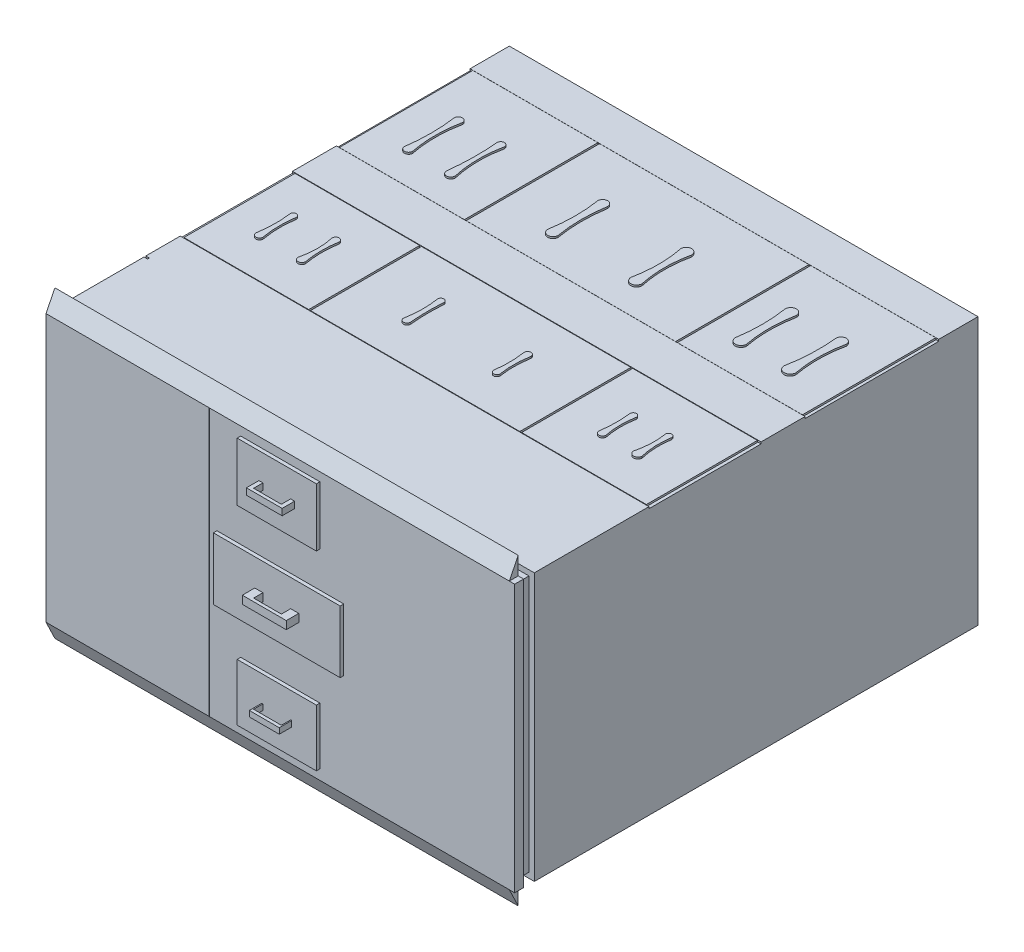
from build123d import *

# Parameters (mm, degrees)
CROQUIS1_W               = 2630
CROQUIS1_H               = 1500
SALIENTE_EXTRUIR1_DEPTH  = 2600
CROQUIS2_W               = 1800
CROQUIS2_H               = 700
CROQUIS2_W_2             = 1799.529620384
CROQUIS2_H_2             = 699.447644672
CORTAR_EXTRUIR1_DEPTH    = 5
SALIENTE_EXTRUIR2_DEPTH  = 10
CROQUIS4_W               = 450.404704805
CROQUIS4_H               = 325.292286803
CROQUIS4_W_2             = 449.824109855
CROQUIS4_H_2             = 324.872968229
CORTAR_EXTRUIR2_DEPTH    = 5
SALIENTE_EXTRUIR3_DEPTH  = 130
CROQUIS6_W               = 36.368934158
CROQUIS6_H               = 354.597108044
SALIENTE_EXTRUIR4_DEPTH  = 10
CROQUIS7_W               = 21.297501653
CROQUIS7_H               = 33.237257885
SALIENTE_EXTRUIR5_DEPTH  = 10
SALIENTE_EXTRUIR6_DEPTH  = 10
CROQUIS9_W               = 183.690091252
CROQUIS9_H               = 126.833634436
CROQUIS9_W_2             = 181.608248232
CROQUIS9_H_2             = 123.361445319
CORTAR_EXTRUIR3_DEPTH    = 5
CROQUIS10_W              = 10
CROQUIS10_H              = 1500
CORTAR_EXTRUIR4_DEPTH    = 20
CORTAR_EXTRUIR5_DEPTH    = 20
SALIENTE_EXTRUIR7_DEPTH  = 20
SALIENTE_EXTRUIR8_DEPTH  = 10
CROQUIS16_W              = 60
CROQUIS16_H              = 1500
CORTAR_EXTRUIR8_DEPTH    = 30
CROQUIS17_W              = 2760.288636549
CROQUIS17_H              = 60
CORTAR_EXTRUIR9_DEPTH    = 30
CROQUIS18_W              = 60
CROQUIS18_H              = 1753.143634975
CORTAR_EXTRUIR10_DEPTH   = 30
CORTAR_EXTRUIR11_DEPTH   = 30
SALIENTE_EXTRUIR9_DEPTH  = 2600
CROQUIS28_W              = 2630
CROQUIS28_H              = 629.145682688
CROQUIS28_W_2            = 2595.025279832
CROQUIS28_H_2            = 623.263175044
CORTAR_EXTRUIR18_DEPTH   = 10
CROQUIS29_W              = 10
CROQUIS29_H              = 623.263175044
CORTAR_EXTRUIR19_DEPTH   = 10
CROQUIS30_W              = 2598.455130778
CROQUIS30_H              = 748.428607785
CORTAR_EXTRUIR20_DEPTH   = 10
CROQUIS31_W              = 10
CROQUIS31_H              = 748.428607785
CORTAR_EXTRUIR21_DEPTH   = 10
SALIENTE_EXTRUIR11_DEPTH = 10
CROQUIS34_W              = 449.238561781
CROQUIS34_H              = 310.138060974
SALIENTE_EXTRUIR14_DEPTH = 120
CORTAR_EXTRUIR22_DEPTH   = 10
CROQUIS36_W              = 711.625853318
CROQUIS36_H              = 348.518627864
CROQUIS36_W_2            = 444.143177104
CROQUIS36_H_2            = 319.493196589
CROQUIS36_H_3            = 326.923270929
SALIENTE_EXTRUIR15_DEPTH = 20
CROQUIS37_W              = 167.825686446
CROQUIS37_H              = 31.773492639
CROQUIS37_W_2            = 246.733883874
CROQUIS37_H_2            = 44.430105756
CROQUIS37_W_3            = 200.17608868
CROQUIS37_H_3            = 36.196774544
SALIENTE_EXTRUIR16_DEPTH = 70
CORTAR_EXTRUIR23_REACH   = 3365.192
CROQUIS38_W              = 155.639527751
CROQUIS38_H              = 52.262528146


with BuildPart() as part:
    # Croquis1 → Saliente-Extruir1 (new body)
    with BuildSketch(Plane.XY):
        Rectangle(CROQUIS1_W, CROQUIS1_H)
    extrude(amount=SALIENTE_EXTRUIR1_DEPTH)

    # Croquis2 → Cortar-Extruir1 (cut)
    with BuildSketch(Plane.ZY.offset(1315)):
        with Locations((1100, 250)):
            Rectangle(CROQUIS2_W, CROQUIS2_H)
        with Locations((1100, 250)):
            Rectangle(CROQUIS2_W_2, CROQUIS2_H_2, mode=Mode.SUBTRACT)
    extrude(amount=-CORTAR_EXTRUIR1_DEPTH, mode=Mode.SUBTRACT)

    # Croquis3 → Saliente-Extruir2 (add)
    # profile 1 of 3: a face of its own
    with BuildSketch(Plane.ZY.offset(1315)):
        Polygon((1451.428346607, 458.306168135), (1451.428346607, 441.34569805), (1402.879000987, 441.34569805), (1451.428346607, 391.974829661), (1451.428346607, 370.959747195), (1392.013699839, 434.402505609), (1319.13667994, 365.87160617), (1319.13667994, 385.853159989), (1381.14839869, 441.34569805), (1319.13667994, 441.34569805), (1319.13667994, 458.306168135), align=None)
    # profile 2 of 3: a face of its own
    with BuildSketch(Plane.ZY.offset(1315)):
        Polygon((1451.428346607, 359.93544164), (1451.428346607, 342.868968616), (1349.957034174, 300.653298544), (1451.428346607, 258.464129206), (1451.428346607, 241.212151041), (1319.13667994, 297.950223624), (1319.13667994, 303.382874198), align=None)
    # profile 3 of 3: a face of its own
    with BuildSketch(Plane.ZY.offset(1315)):
        Polygon((1451.428346607, 162.345965144), (1319.13667994, 100.440249332), (1319.13667994, 117.851231904), (1361.537855154, 137.938788662), (1361.537855154, 192.053288528), (1319.13667994, 212.140845286), (1319.13667994, 229.339821982), (1451.428346607, 167.646112046), align=None)
        Polygon((1422.516045258, 164.996038595), (1376.802278231, 185.587109308), (1376.802278231, 144.192962006), align=None, mode=Mode.SUBTRACT)
    extrude(amount=SALIENTE_EXTRUIR2_DEPTH)

    # Croquis4 → Cortar-Extruir2 (cut)
    with BuildSketch(Plane.ZY.offset(1315)):
        with Locations((1751.678268216, -602.298423141)):
            Rectangle(CROQUIS4_W, CROQUIS4_H)
        with Locations((1751.678268216, -602.298423141)):
            Rectangle(CROQUIS4_W_2, CROQUIS4_H_2, mode=Mode.SUBTRACT)
    extrude(amount=-CORTAR_EXTRUIR2_DEPTH, mode=Mode.SUBTRACT)

    # Croquis5 → Saliente-Extruir3 (add)
    with BuildSketch(Plane.ZY.offset(1315)):
        with BuildLine():
            ThreePointArc((1780.338188778, -740.762940168), (1795.309843088, -725.791285858), (1780.338188778, -710.819631547))
            ThreePointArc((1780.338188778, -710.819631547), (1714.328057514, -713.624314209), (1648.31792625, -710.819631548))
            ThreePointArc((1648.31792625, -710.819631548), (1636.198610494, -725.791285858), (1648.31792625, -740.762940168))
            ThreePointArc((1648.31792625, -740.762940168), (1714.328057514, -738.509072299), (1780.338188778, -740.762940168))
        make_face()
    extrude(amount=SALIENTE_EXTRUIR3_DEPTH)

    # Croquis6 → Saliente-Extruir4 (add)
    with BuildSketch(Plane.ZY.offset(1315)):
        with Locations((1994.189242148, -605.938703863)):
            Rectangle(CROQUIS6_W, CROQUIS6_H)
    extrude(amount=SALIENTE_EXTRUIR4_DEPTH)

    # Croquis7 → Saliente-Extruir5 (add)
    with BuildSketch(Plane.ZY.offset(1315)):
        Polygon((2002.808835933, -428.640149841), (2002.808835933, -392.560968391), (1981.51133428, -392.560968391), (1981.51133428, -403.619286557), (1981.51133428, -428.640149841), align=None)
        with Locations((1992.160085106, -766.618628942)):
            Rectangle(CROQUIS7_W, CROQUIS7_H)
    extrude(amount=SALIENTE_EXTRUIR5_DEPTH)

    # Croquis8 → Saliente-Extruir6 (add)
    with BuildSketch(Plane.ZY.offset(1315)):
        with BuildLine():
            ThreePointArc((1260.140615326, -2.534811026), (1272.093135714, 9.428872223), (1259.46675366, 20.67906941))
            ThreePointArc((1259.46675366, 20.67906941), (1157.366046695, 22.604479394), (1056.267698846, 37.005369241))
            ThreePointArc((1056.267698846, 37.005369241), (1030.166477062, 10.90414748), (1056.267698822, -15.197074304))
            ThreePointArc((1056.267698822, -15.197074304), (1157.96361366, -4.992994657), (1260.140615326, -2.534811026))
        make_face()
    extrude(amount=SALIENTE_EXTRUIR6_DEPTH)

    # Croquis9 → Cortar-Extruir3 (cut)
    with BuildSketch(Plane.ZY.offset(1315)):
        with Locations((1894.113843693, 305.667457409)):
            Rectangle(CROQUIS9_W, CROQUIS9_H)
        with Locations((1894.113843693, 305.667457409)):
            Rectangle(CROQUIS9_W_2, CROQUIS9_H_2, mode=Mode.SUBTRACT)
    extrude(amount=-CORTAR_EXTRUIR3_DEPTH, mode=Mode.SUBTRACT)

    # Croquis10 → Cortar-Extruir4 (cut)
    with BuildSketch(Plane.ZY.offset(1315)):
        with Locations((2045, 0)):
            Rectangle(CROQUIS10_W, CROQUIS10_H)
    extrude(amount=-CORTAR_EXTRUIR4_DEPTH, mode=Mode.SUBTRACT)

    # Croquis11 → Cortar-Extruir5 (cut)
    with BuildSketch(Plane.XZ.offset(750)):
        Polygon((-1315, 2050), (1315, 2050), (1309.778062948, 2050), (1309.778062948, 2040), (-1341.437489321, 2040), (-1341.437489321, 2050), align=None)
    extrude(amount=-CORTAR_EXTRUIR5_DEPTH, mode=Mode.SUBTRACT)

    # Croquis14 → Saliente-Extruir7 (add)
    with BuildSketch(Plane.ZY.offset(1315)):
        Polygon((2370.241263248, 341.809245321), (2353.006468194, 332.408448019), (2310.702880335, 360.610839925), (2291.901285731, 332.408448019), (2249.597697871, 360.610839925), (2233.929702368, 337.10884667), (2214.525492552, 308.002531946), (2241.76370012, 313.45017346), (2241.76370012, 294.021859035), (2282.500488429, 313.45017346), (2259.967305246, 274.408980425), (2313.876620348, 308.002531946), (2305.697275987, 282.960113165), (2386.48984326, 323.969708856), align=None)
    extrude(amount=SALIENTE_EXTRUIR7_DEPTH)

    # Croquis15 → Saliente-Extruir8 (add)
    with BuildSketch(Plane.ZY.offset(1315)):
        Polygon((2440.380965268, 319.487061413), (2183.800386024, 467.623927909), (2183.800386024, 171.350194918), align=None)
    extrude(amount=SALIENTE_EXTRUIR8_DEPTH)

    # Croquis16 → Cortar-Extruir8 (cut)
    with BuildSketch(Plane.ZY.offset(1315)):
        with Locations((2520, 0)):
            Rectangle(CROQUIS16_W, CROQUIS16_H)
    extrude(amount=-CORTAR_EXTRUIR8_DEPTH, mode=Mode.SUBTRACT)

    # Croquis17 → Cortar-Extruir9 (cut)
    with BuildSketch(Plane.XZ.offset(750)):
        with Locations((8.229365349, 2520)):
            Rectangle(CROQUIS17_W, CROQUIS17_H)
    extrude(amount=-CORTAR_EXTRUIR9_DEPTH, mode=Mode.SUBTRACT)

    # Croquis18 → Cortar-Extruir10 (cut)
    with BuildSketch(Plane(origin=(1315, 0, 0), x_dir=(0, 0, -1), z_dir=(1, 0, 0))):
        with Locations((-2520, -41.281003262)):
            Rectangle(CROQUIS18_W, CROQUIS18_H)
    extrude(amount=-CORTAR_EXTRUIR10_DEPTH, mode=Mode.SUBTRACT)

    # Croquis19 → Cortar-Extruir11 (cut)
    with BuildSketch(Plane(origin=(0, 750, 0), x_dir=(1, 0, 0), z_dir=(0, 1, 0))):
        Polygon((1315, -2550), (-1411.684145775, -2550), (-1411.684145775, -2490), (1341.505046695, -2490), (1341.505046695, -2550), align=None)
    extrude(amount=-CORTAR_EXTRUIR11_DEPTH, mode=Mode.SUBTRACT)

    # Croquis20 → Saliente-Extruir9 (add)
    with BuildSketch(Plane.ZY.offset(1315)):
        Polygon((2550, -750), (2550, -853.768316532), (2600, -750), align=None)
        Polygon((2550, 750), (2550, 850.121406684), (2600, 750), align=None)
    extrude(amount=-SALIENTE_EXTRUIR9_DEPTH)

    # Croquis28 → Cortar-Extruir18 (cut)
    with BuildSketch(Plane(origin=(0, 750, 0), x_dir=(1, 0, 0), z_dir=(0, 1, 0))):
        with Locations((0, -1531.907861365)):
            Rectangle(CROQUIS28_W, CROQUIS28_H)
        with Locations((0, -1531.907861365)):
            Rectangle(CROQUIS28_W_2, CROQUIS28_H_2, mode=Mode.SUBTRACT)
    extrude(amount=-CORTAR_EXTRUIR18_DEPTH, mode=Mode.SUBTRACT)

    # Croquis29 → Cortar-Extruir19 (cut)
    with BuildSketch(Plane(origin=(0, 750, 0), x_dir=(1, 0, 0), z_dir=(0, 1, 0))):
        Polygon((-597.512639916, -1531.907861365), (-597.512639916, -1843.539448887), (-587.512639916, -1843.539448887), (-587.512639916, -1220.276273843), (-597.512639916, -1220.276273843), align=None)
        with Locations((592.512639916, -1531.907861365)):
            Rectangle(CROQUIS29_W, CROQUIS29_H)
    extrude(amount=-CORTAR_EXTRUIR19_DEPTH, mode=Mode.SUBTRACT)

    # Croquis30 → Cortar-Extruir20 (cut)
    with BuildSketch(Plane(origin=(0, 750, 0), x_dir=(1, 0, 0), z_dir=(0, 1, 0))):
        Polygon((1315, -220.276273843), (1315, -970.276273843), (1003.710087888, -970.276273843), (-1315, -970.276273843), (-1315, -220.276273843), align=None)
        with Locations((0, -595.276273844)):
            Rectangle(CROQUIS30_W, CROQUIS30_H, mode=Mode.SUBTRACT)
    extrude(amount=-CORTAR_EXTRUIR20_DEPTH, mode=Mode.SUBTRACT)

    # Croquis31 → Cortar-Extruir21 (cut)
    with BuildSketch(Plane(origin=(0, 750, 0), x_dir=(1, 0, 0), z_dir=(0, 1, 0))):
        with Locations((592.512639916, -595.276273844)):
            Rectangle(CROQUIS31_W, CROQUIS31_H)
        with Locations((-592.512639916, -595.276273844)):
            Rectangle(CROQUIS31_W, CROQUIS31_H)
    extrude(amount=-CORTAR_EXTRUIR21_DEPTH, mode=Mode.SUBTRACT)

    # Croquis32 → Saliente-Extruir11 (add)
    with BuildSketch(Plane(origin=(0, 750, 0), x_dir=(1, 0, 0), z_dir=(0, 1, 0))):
        with BuildLine():
            ThreePointArc((226.132181741, -1629.248481696), (244.216691357, -1647.332991312), (262.301200974, -1629.248481696))
            ThreePointArc((262.301200974, -1629.248481696), (255.775343674, -1543.127511391), (263.538442728, -1457.10924221))
            ThreePointArc((263.538442728, -1457.10924221), (244.216691357, -1437.78749084), (224.894939987, -1457.10924221))
            ThreePointArc((224.894939987, -1457.10924221), (231.966326068, -1543.132483042), (226.132181741, -1629.248481696))
        make_face()
        with BuildLine():
            ThreePointArc((-279.543889629, -1629.248481647), (-259.905367125, -1648.887004151), (-240.266844621, -1629.248481647))
            ThreePointArc((-240.266844621, -1629.248481647), (-245.37928971, -1534.440792365), (-242.34013861, -1439.544013692))
            ThreePointArc((-242.34013861, -1439.544013692), (-259.905367128, -1421.978785173), (-277.470595647, -1439.544013692))
            ThreePointArc((-277.470595647, -1439.544013692), (-270.416905041, -1534.48466756), (-279.543889629, -1629.248481647))
        make_face()
        with BuildLine():
            ThreePointArc((-871.272882736, -1629.248481693), (-850.106436384, -1650.414928045), (-828.939990032, -1629.248481693))
            ThreePointArc((-828.939990032, -1629.248481693), (-838.011209555, -1534.462410352), (-830.449178105, -1439.544013694))
            ThreePointArc((-830.449178105, -1439.544013694), (-850.106436384, -1419.886755415), (-869.763694662, -1439.544013694))
            ThreePointArc((-869.763694662, -1439.544013694), (-859.696987068, -1534.482336227), (-871.272882736, -1629.248481693))
        make_face()
        with BuildLine():
            ThreePointArc((-1071.131810389, -1444.662926526), (-1087.721816476, -1421.980074129), (-1104.856487593, -1444.254344948))
            ThreePointArc((-1104.856487593, -1444.254344948), (-1099.59382841, -1536.879442646), (-1108.257830429, -1629.248481693))
            ThreePointArc((-1108.257830429, -1629.248481693), (-1087.934607309, -1649.571704814), (-1067.611384188, -1629.248481693))
            ThreePointArc((-1067.611384188, -1629.248481693), (-1076.882026094, -1537.098943435), (-1071.131810389, -1444.662926526))
        make_face()
        with BuildLine():
            ThreePointArc((816.998710497, -1629.248481693), (837.104419006, -1649.354190203), (857.210127516, -1629.248481693))
            ThreePointArc((857.210127516, -1629.248481693), (847.874495027, -1543.276794317), (855.184626919, -1457.10924221))
            ThreePointArc((855.184626919, -1457.10924221), (837.104419006, -1439.029034298), (819.024211094, -1457.10924221))
            ThreePointArc((819.024211094, -1457.10924221), (823.893120396, -1543.248069328), (816.998710497, -1629.248481693))
        make_face()
        with BuildLine():
            ThreePointArc((1011.509421343, -1629.248481693), (1035.822604481, -1653.56166483), (1060.135787618, -1629.248481693))
            ThreePointArc((1060.135787618, -1629.248481693), (1048.139948657, -1543.521725171), (1053.225194455, -1457.10924221))
            ThreePointArc((1053.225194455, -1457.10924221), (1035.822604481, -1439.706652236), (1018.420014506, -1457.10924221))
            ThreePointArc((1018.420014506, -1457.10924221), (1023.774738949, -1543.53254349), (1011.509421343, -1629.248481693))
        make_face()
        with BuildLine():
            ThreePointArc((-1110.941303897, -792.722381827), (-1087.934607309, -815.729078416), (-1064.92791072, -792.722381827))
            ThreePointArc((-1064.92791072, -792.722381827), (-1078.843889049, -653.09514267), (-1065.03755994, -513.457018778))
            ThreePointArc((-1065.03755994, -513.457018778), (-1087.934607309, -490.559971409), (-1110.831654678, -513.457018778))
            ThreePointArc((-1110.831654678, -513.457018778), (-1101.2084058, -653.093500248), (-1110.941303897, -792.722381827))
        make_face()
        with BuildLine():
            ThreePointArc((-874.747338414, -792.722381828), (-850.106436384, -817.363283858), (-825.465534354, -792.722381828))
            ThreePointArc((-825.465534354, -792.722381828), (-842.500668172, -653.296848859), (-829.290938776, -513.457018778))
            ThreePointArc((-829.290938776, -513.457018778), (-850.106436384, -492.64152117), (-870.921933992, -513.457018778))
            ThreePointArc((-870.921933992, -513.457018778), (-865.253228012, -653.193551178), (-874.747338414, -792.722381828))
        make_face()
        with BuildLine():
            ThreePointArc((-306.755127334, -792.722381828), (-277.470595647, -822.006913515), (-248.186063961, -792.722381828))
            ThreePointArc((-248.186063961, -792.722381828), (-260.406608498, -653.145243458), (-249.529147842, -513.457018778))
            ThreePointArc((-249.529147842, -513.457018778), (-277.470595647, -485.515570972), (-305.412043453, -513.457018778))
            ThreePointArc((-305.412043453, -513.457018778), (-294.570980594, -653.145068408), (-306.755127334, -792.722381828))
        make_face()
        with BuildLine():
            ThreePointArc((160.137442869, -792.722381827), (191.199810409, -823.784749368), (222.262177949, -792.722381827))
            ThreePointArc((222.262177949, -792.722381827), (206.811244996, -653.127651317), (221.56029655, -513.457018778))
            ThreePointArc((221.56029655, -513.457018778), (191.199810409, -483.096532637), (160.839324268, -513.457018778))
            ThreePointArc((160.839324268, -513.457018778), (174.569330988, -653.125090138), (160.137442869, -792.722381827))
        make_face()
        with BuildLine():
            ThreePointArc((746.264182029, -792.722381827), (777.788486267, -824.246686066), (809.312790505, -792.722381827))
            ThreePointArc((809.312790505, -792.722381827), (795.803294762, -653.085241277), (809.404654181, -513.457018778))
            ThreePointArc((809.404654181, -513.457018778), (777.788486267, -481.840850864), (746.172318352, -513.457018778))
            ThreePointArc((746.172318352, -513.457018778), (757.238881918, -653.086075092), (746.264182029, -792.722381827))
        make_face()
        with BuildLine():
            ThreePointArc((1019.717085774, -792.722381827), (1053.225194455, -826.230490508), (1086.733303136, -792.722381827))
            ThreePointArc((1086.733303136, -792.722381827), (1074.109664611, -652.96594008), (1089.225224039, -513.457018778))
            ThreePointArc((1089.225224039, -513.457018778), (1060.135787618, -484.367582356), (1031.046351196, -513.457018778))
            ThreePointArc((1031.046351196, -513.457018778), (1035.693940232, -653.508047555), (1019.717085774, -792.722381827))
        make_face()
    extrude(amount=SALIENTE_EXTRUIR11_DEPTH)

    # Croquis34 → Saliente-Extruir14 (add)
    with BuildSketch(Plane.ZY.offset(1315)):
        with Locations((1751.385494179, -594.930969513)):
            Rectangle(CROQUIS34_W, CROQUIS34_H)
    extrude(amount=SALIENTE_EXTRUIR14_DEPTH)

    # Croquis35 → Cortar-Extruir22 (cut)
    with BuildSketch(Plane.XY.offset(2600)):
        Polygon((-400, 750), (-400, 0), (-400, -56.399649768), (-400, -750), (-397.60445157, -750), (-397.60445157, 750), align=None)
    extrude(amount=-CORTAR_EXTRUIR22_DEPTH, mode=Mode.SUBTRACT)

    # Croquis36 → Saliente-Extruir15 (add)
    with BuildSketch(Plane.XY.offset(2600)):
        Rectangle(CROQUIS36_W, CROQUIS36_H)
        with Locations((0, -534.005912227)):
            Rectangle(CROQUIS36_W_2, CROQUIS36_H_2)
        with Locations((0, 537.720949397)):
            Rectangle(CROQUIS36_W_2, CROQUIS36_H_3)
    extrude(amount=SALIENTE_EXTRUIR15_DEPTH)

    # Croquis37 → Saliente-Extruir16 (add)
    with BuildSketch(Plane.XY.offset(2620)):
        with Locations((0, -534.005912226)):
            Rectangle(CROQUIS37_W, CROQUIS37_H)
        Rectangle(CROQUIS37_W_2, CROQUIS37_H_2)
        with Locations((0, 537.720949396)):
            Rectangle(CROQUIS37_W_3, CROQUIS37_H_3)
    extrude(amount=SALIENTE_EXTRUIR16_DEPTH)

    # Cortar-Extruir23: up to this face of the body (flat: up to its plane)
    cortar_extruir23_end = Plane(part.part.faces().sort_by_distance((0, -549.892658546, 2655))[0])
    # Croquis38 → Cortar-Extruir23 (cut, up to the picked face)
    with BuildSketch(Plane(origin=(0, 555.819336668, 0), x_dir=(1, 0, 0), z_dir=(0, 1, 0)), mode=Mode.PRIVATE) as cortar_extruir23_sk1:
        with Locations((0.18108073, -2646.131264073)):
            Rectangle(CROQUIS38_W, CROQUIS38_H)
    cortar_extruir23_tool1 = split(extrude(cortar_extruir23_sk1.sketch, amount=-CORTAR_EXTRUIR23_REACH, mode=Mode.PRIVATE), bisect_by=cortar_extruir23_end, keep=Keep.BOTH, mode=Mode.PRIVATE)
    add(cortar_extruir23_tool1.solids().sort_by(Axis((0.181081, 555.819337, 2646.131264), (0, -1, 0)))[0], mode=Mode.SUBTRACT)


solid = part.part
